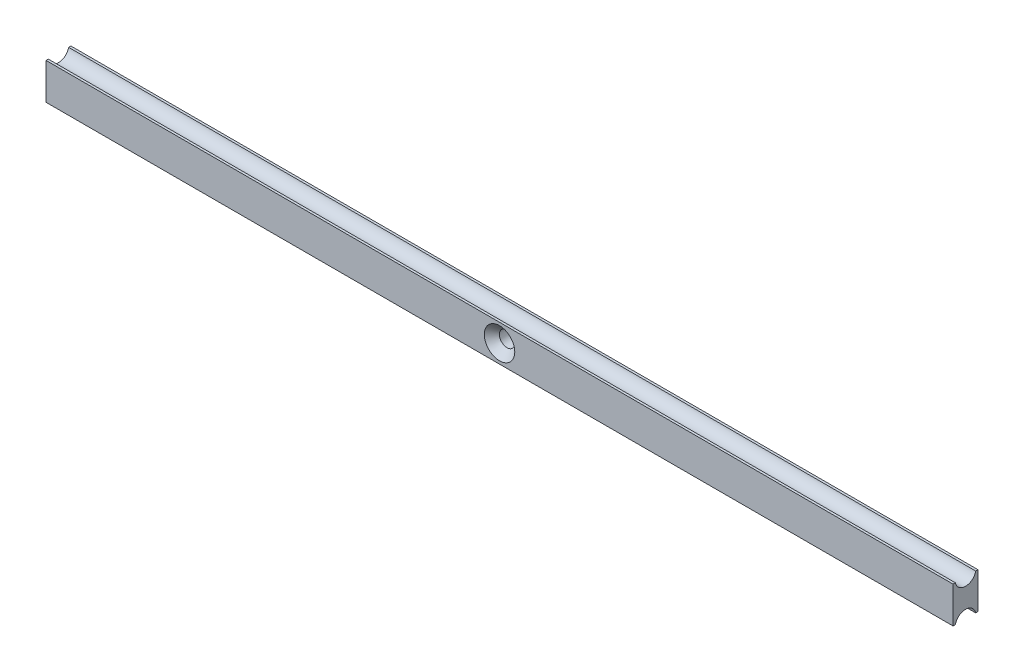
from build123d import *

# Parameters (mm, degrees)
SKETCH1_W               = 200
SKETCH1_H               = 8
BOSS_EXTRUDE1_DEPTH     = 2.75
BEARING_CUTS_DEPTH      = 101.117743183
BEARING_CUTS_DEPTH_BACK = 101.117743183
SKETCH2_R               = 2.3


with BuildPart() as part:
    # Sketch1 → Boss-Extrude1 (new, symmetric)
    with BuildSketch(Plane.XY):
        Rectangle(SKETCH1_W, SKETCH1_H)
    extrude(amount=BOSS_EXTRUDE1_DEPTH, both=True)

    # Sketch2 → Bearing Cuts (cut, two sides: drawn at the far end of the back side and taken through both)
    with BuildSketch(Plane(origin=(0, 0, 0), x_dir=(0, 0, -1), z_dir=(1, 0, 0)).offset(-BEARING_CUTS_DEPTH_BACK)):
        with Locations((0, 4.5)):
            Circle(SKETCH2_R)
        with Locations((0, -4.5)):
            Circle(SKETCH2_R)
    extrude(amount=BEARING_CUTS_DEPTH + BEARING_CUTS_DEPTH_BACK, mode=Mode.SUBTRACT)

    # Sketch5 → CSK for M3 SFHCS1 (revolve, cut)
    with BuildSketch(Plane(origin=(0, 0, 2.75), x_dir=(0, -1, 0), z_dir=(1, 0, 0))):
        Polygon((0, 0), (0, 5.5), (2, 5.5), (1.7, 5.2), (1.7, 1.66), (3.36, 0), align=None)
    revolve(axis=Axis((0, 0, 9.1), (0, 0, -1)), mode=Mode.SUBTRACT)


solid = part.part
